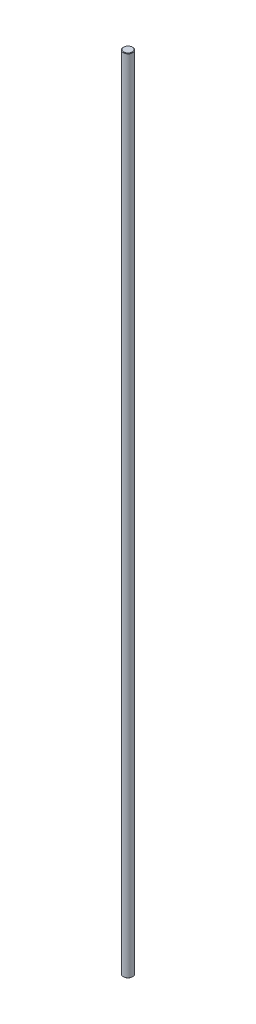
from build123d import *

# Parameters (mm, degrees)
SZKIC1_R                    = 2.5
DODANIE_WYCI_GNI_CIE1_DEPTH = 423
SFAZOWANIE1_SIZE            = 0.25


with BuildPart() as part:
    # Szkic1 → Dodanie-wyciągnięcie1 (new body)
    with BuildSketch(Plane(origin=(0, 0, 0), x_dir=(1, 0, 0), z_dir=(0, 1, 0))):
        with Locations(Location((0, 0, 0), (0, 0, 90))):
            Circle(SZKIC1_R)
    extrude(amount=DODANIE_WYCI_GNI_CIE1_DEPTH)

    # Sfazowanie1
    sfazowanie1_edges = [part.edges().sort_by_distance(p)[0] for p in [
        (0, 0, 2.5),
        (0, 423, 2.5),
    ]]
    chamfer(sfazowanie1_edges, length=SFAZOWANIE1_SIZE)


solid = part.part
